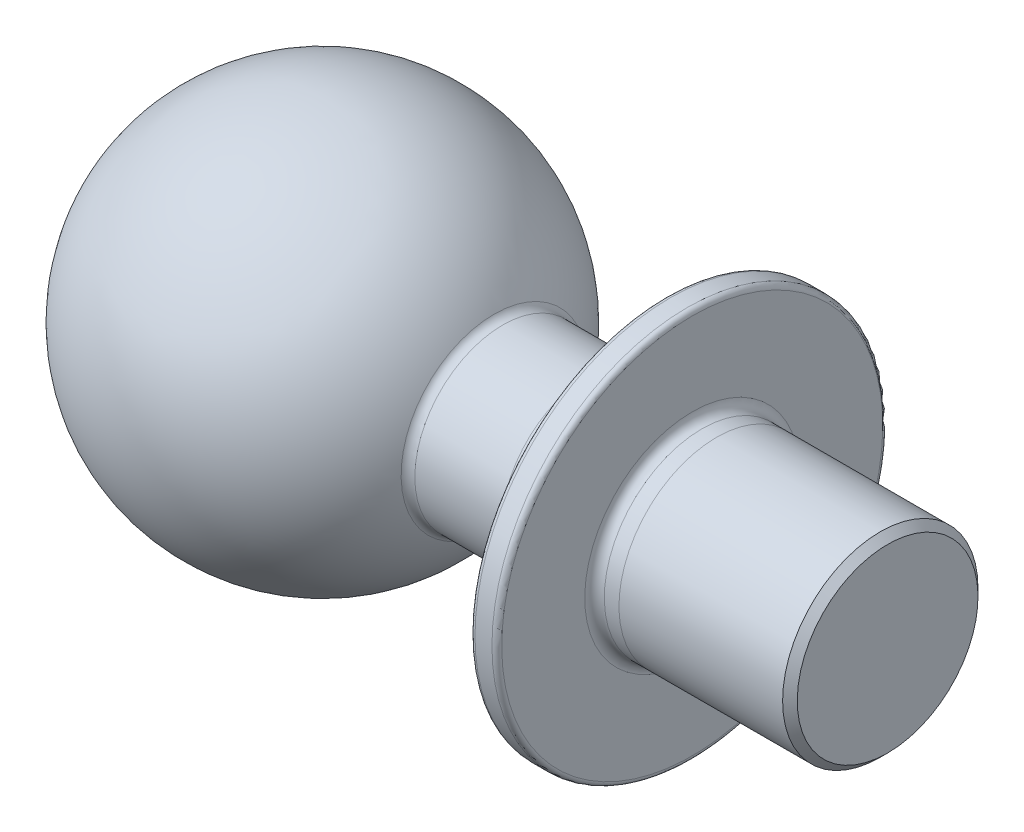
from build123d import *

# Parameters (mm, degrees)
CHAMFER1_SIZE      = 0.075
FILLET1_R          = 0.1
FILLET2_R          = 0.05
CUT_EXTRUDE1_DEPTH = 1
FILLET3_R          = 0.05


with BuildPart() as part:
    # Sketch1 → Revolve1 (revolve)
    with BuildSketch(Plane.XY):
        with BuildLine():
            Line((0, 0), (0, 1))
            Line((0, 1), (-2, 1))
            Line((-2, 1), (-2, 2))
            Line((-2, 2), (-2.25, 2))
            Line((-2.25, 2), (-3, 0.9))
            Line((-3, 0.9), (-4, 0.9))
            ThreePointArc((-4, 0.9), (-5.800005741, 1.999951358), (-7.584493931, 0.875))
            Line((-7.584493931, 0.875), (-7.584493931, 0))
            Line((-7.584493931, 0), (-4, 0))
            Line((-4, 0), (0, 0))
        make_face()
    revolve(axis=Axis((0, 0, 0), (-1, 0, 0)))

    # Chamfer1
    chamfer1_edges = [part.edges().sort_by_distance(p)[0] for p in [
        (0, -1, 0),
    ]]
    chamfer(chamfer1_edges, length=CHAMFER1_SIZE)

    # Fillet1
    fillet1_edges = [part.edges().sort_by_distance(p)[0] for p in [
        (-3, -0.9, 0),
        (-4, -0.9, 0),
        (-2, -1, 0),
    ]]
    fillet(fillet1_edges, radius=FILLET1_R)

    # Fillet2
    fillet2_edges = [part.edges().sort_by_distance(p)[0] for p in [
        (-2, -2, 0),
        (-2.25, -2, 0),
    ]]
    fillet(fillet2_edges, radius=FILLET2_R)

    # Sketch3 → Cut-Extrude1 (cut)
    with BuildSketch(Plane.ZY.offset(7.584493931)):
        Polygon((0, 0.66395281), (-0.575, 0.331976405), (-0.575, -0.331976405), (0, -0.66395281), (0.575, -0.331976405), (0.575, 0.331976405), align=None)
    extrude(amount=-CUT_EXTRUDE1_DEPTH, mode=Mode.SUBTRACT)

    # Fillet3
    fillet3_edges = [part.edges().sort_by_distance(p)[0] for p in [
        (-6.584493931, 0, 0.575),
        (-7.084493931, 0.331976405, 0.575),
        (-6.584493931, -0.497964607, 0.2875),
        (-7.084493931, -0.331976405, 0.575),
        (-6.584493931, -0.497964607, -0.2875),
        (-7.084493931, -0.66395281, 0),
        (-6.584493931, 0, -0.575),
        (-7.084493931, -0.331976405, -0.575),
        (-6.584493931, 0.497964607, -0.2875),
        (-7.084493931, 0.331976405, -0.575),
        (-6.584493931, 0.497964607, 0.2875),
        (-7.084493931, 0.66395281, 0),
        (-7.584493931, 0, 0.575),
        (-7.584493931, 0.497964607, 0.2875),
        (-7.584493931, 0.497964607, -0.2875),
        (-7.584493931, 0, -0.575),
        (-7.584493931, -0.497964607, -0.2875),
        (-7.584493931, -0.497964607, 0.2875),
    ]]
    fillet(fillet3_edges, radius=FILLET3_R)


solid = part.part
